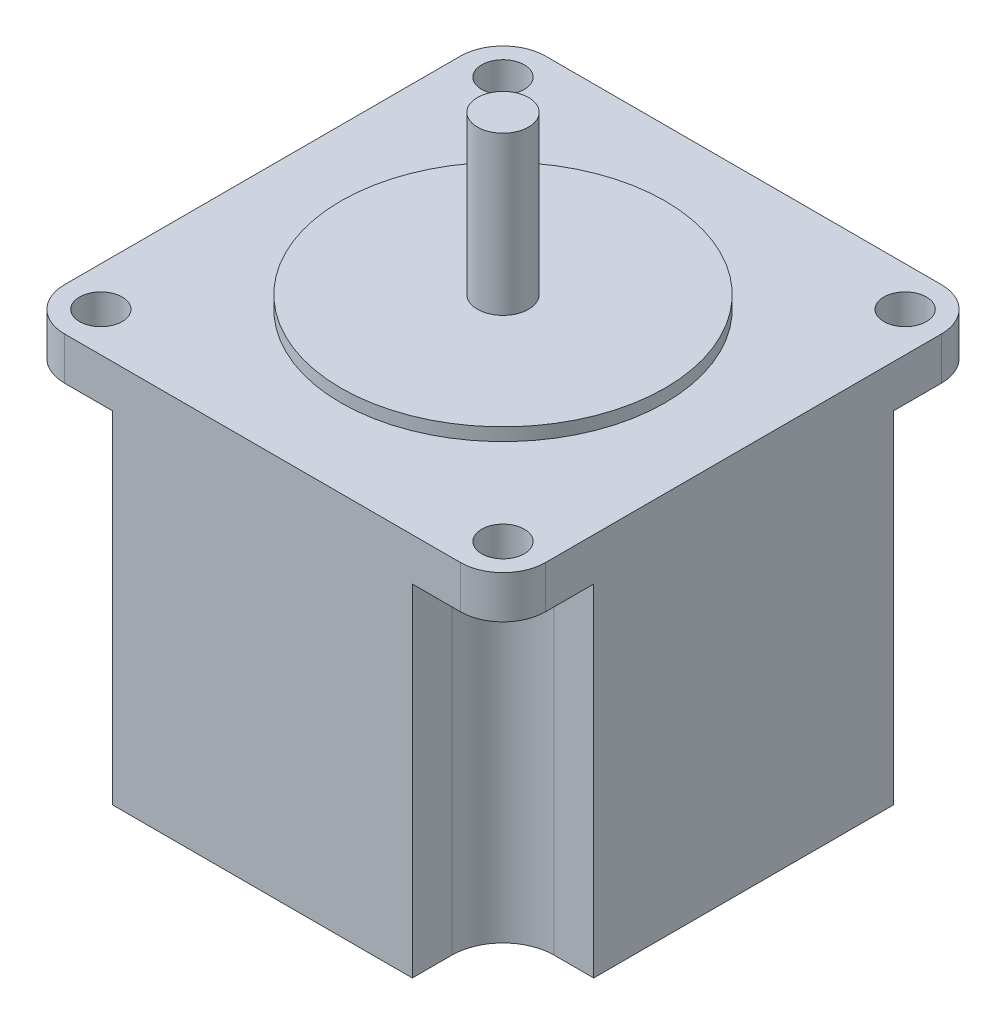
from build123d import *

# Parameters (mm, degrees)
BOSS_EXTRUDE1_DEPTH     = 45
SKETCH3_OUTSIDE_W       = 76.716
SKETCH3_OUTSIDE_H       = 76.716
CUT_EXTRUDE1_DEPTH      = 40
CUT_EXTRUDE3_DEPTH      = 61.128861622
CUT_EXTRUDE3_DEPTH_BACK = 61.128861622
SKETCH4_R               = 2.5
SKETCH5_R               = 19
BOSS_EXTRUDE2_DEPTH     = 1.5
SKETCH6_R               = 3
BOSS_EXTRUDE3_DEPTH     = 18.5


with BuildPart() as part:
    # Sketch2 → Boss-Extrude1 (new body)
    with BuildSketch(Plane(origin=(0, 0, 0), x_dir=(1, 0, 0), z_dir=(0, 1, 0))):
        with BuildLine():
            Line((-28.2, -23.2), (-28.2, 23.2))
            ThreePointArc((-28.2, 23.2), (-26.735533906, 26.735533906), (-23.2, 28.2))
            Line((-23.2, 28.2), (23.2, 28.2))
            ThreePointArc((23.2, 28.2), (26.735533906, 26.735533906), (28.2, 23.2))
            Line((28.2, 23.2), (28.2, -23.2))
            ThreePointArc((28.2, -23.2), (26.735533906, -26.735533906), (23.2, -28.2))
            Line((23.2, -28.2), (-23.2, -28.2))
            ThreePointArc((-23.2, -28.2), (-26.735533906, -26.735533906), (-28.2, -23.2))
        make_face()
    extrude(amount=BOSS_EXTRUDE1_DEPTH)

    # Sketch3 outside → Cut-Extrude1 (cut)
    with BuildSketch(Plane.XZ):
        Rectangle(SKETCH3_OUTSIDE_W, SKETCH3_OUTSIDE_H)
        with BuildLine():
            Line((-28.2, 17.57), (-23.57, 17.57))
            ThreePointArc((-23.57, 17.57), (-19.327359313, 19.327359313), (-17.57, 23.57))
            Line((-17.57, 23.57), (-17.57, 28.2))
            Line((-17.57, 28.2), (17.57, 28.2))
            Line((17.57, 28.2), (17.57, 23.57))
            ThreePointArc((17.57, 23.57), (19.327359313, 19.327359313), (23.57, 17.57))
            Line((23.57, 17.57), (28.2, 17.57))
            Line((28.2, 17.57), (28.2, -17.57))
            Line((28.2, -17.57), (23.57, -17.57))
            ThreePointArc((23.57, -17.57), (19.327359313, -19.327359313), (17.57, -23.57))
            Line((17.57, -23.57), (17.57, -28.2))
            Line((17.57, -28.2), (-17.57, -28.2))
            Line((-17.57, -28.2), (-17.57, -23.57))
            ThreePointArc((-17.57, -23.57), (-19.327359313, -19.327359313), (-23.57, -17.57))
            Line((-23.57, -17.57), (-28.2, -17.57))
            Line((-28.2, -17.57), (-28.2, 17.57))
        make_face(mode=Mode.SUBTRACT)
    extrude(amount=-CUT_EXTRUDE1_DEPTH, mode=Mode.SUBTRACT)

    # Sketch4 → Cut-Extrude3 (cut, two sides: drawn at the far end of the back side and taken through both)
    with BuildSketch(Plane(origin=(0, 0, 0), x_dir=(1, 0, 0), z_dir=(0, 1, 0)).offset(-CUT_EXTRUDE3_DEPTH_BACK)):
        with Locations(Location((23.57, -23.57, 0), (0, 0, 90))):
            Circle(SKETCH4_R)
        with Locations(Location((-23.57, -23.57, 0), (0, 0, 90))):
            Circle(SKETCH4_R)
        with Locations(Location((23.57, 23.57, 0), (0, 0, 90))):
            Circle(SKETCH4_R)
        with Locations(Location((-23.57, 23.57, 0), (0, 0, 90))):
            Circle(SKETCH4_R)
    extrude(amount=CUT_EXTRUDE3_DEPTH + CUT_EXTRUDE3_DEPTH_BACK, mode=Mode.SUBTRACT)

    # Sketch5 → Boss-Extrude2 (add)
    with BuildSketch(Plane(origin=(0, 45, 0), x_dir=(1, 0, 0), z_dir=(0, 1, 0))):
        with Locations(Location((0, 0, 0), (0, 0, 270))):
            Circle(SKETCH5_R)
    extrude(amount=BOSS_EXTRUDE2_DEPTH)

    # Sketch6 → Boss-Extrude3 (add)
    with BuildSketch(Plane(origin=(0, 46.5, 0), x_dir=(1, 0, 0), z_dir=(0, 1, 0))):
        with Locations(Location((0, 0, 0), (0, 0, 270))):
            Circle(SKETCH6_R)
    extrude(amount=BOSS_EXTRUDE3_DEPTH)


solid = part.part
